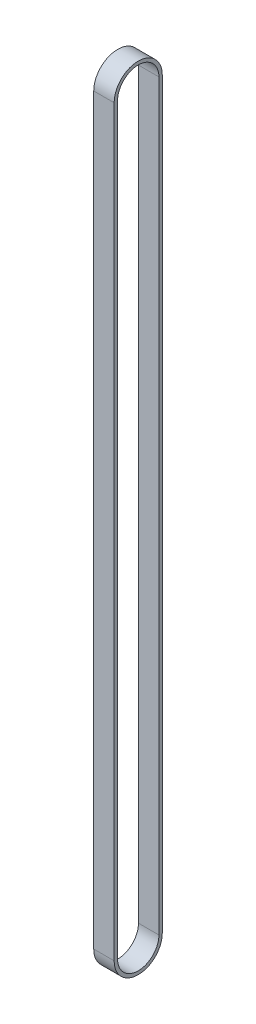
from build123d import *

# Parameters (mm, degrees)
BOSS_EXTRUDE1_DEPTH = 6.05


with BuildPart() as part:
    # Sketch1 → Boss-Extrude1 (new body)
    with BuildSketch(Plane.YZ):
        with BuildLine():
            Line((-110, 7.125), (110, 7.125))
            ThreePointArc((110, 7.125), (117.125, 0), (110, -7.125))
            Line((110, -7.125), (-110, -7.125))
            ThreePointArc((-110, -7.125), (-117.125, 0), (-110, 7.125))
        make_face()
        with BuildLine():
            Line((-110, 6.125), (110, 6.125))
            ThreePointArc((110, 6.125), (116.125, 0), (110, -6.125))
            Line((110, -6.125), (-110, -6.125))
            ThreePointArc((-110, -6.125), (-116.125, 0), (-110, 6.125))
        make_face(mode=Mode.SUBTRACT)
    extrude(amount=BOSS_EXTRUDE1_DEPTH)


solid = part.part
